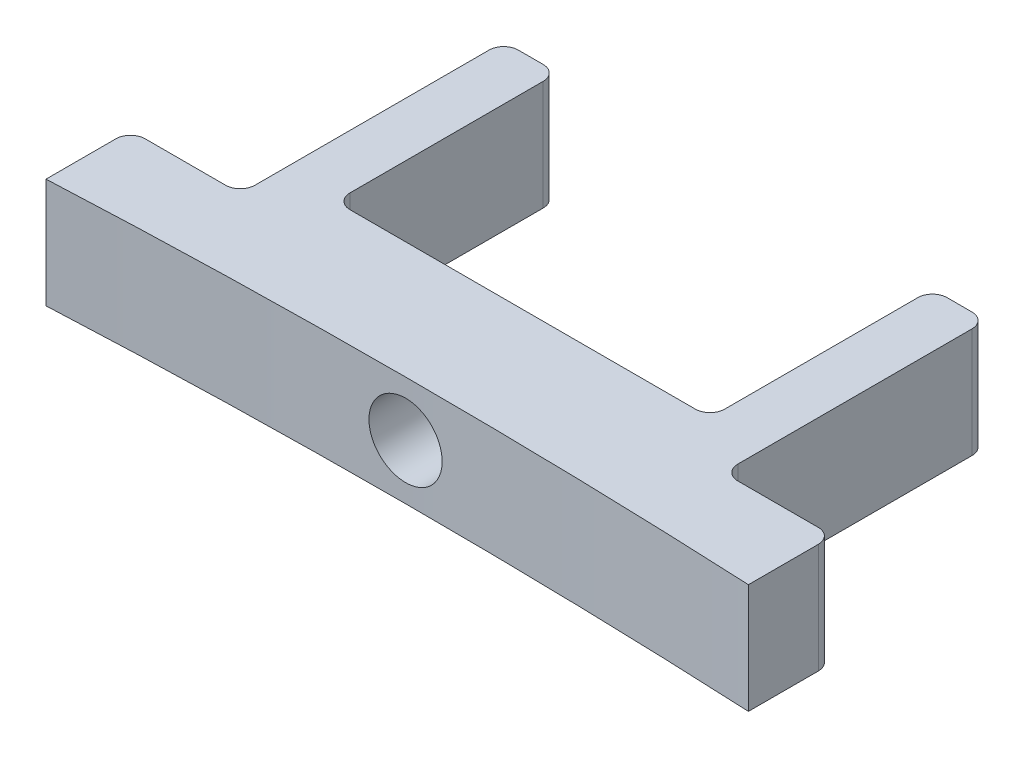
from build123d import *

# Parameters (mm, degrees)
BOSS_EXTRUDE1_DEPTH       = 7.5
BOSS_EXTRUDE2_DEPTH       = 7.5
FILLET1_R                 = 1
M6X1_0_TAPPED_HOLE1_D     = 5
M6X1_0_TAPPED_HOLE1_DEPTH = 9
M6X1_0_TAPPED_HOLE1_TIP   = 1.502151548


with BuildPart() as part:
    # Sketch1 → Boss-Extrude1 (new body)
    with BuildSketch(Plane(origin=(0, 0, 0), x_dir=(1, 0, 0), z_dir=(0, 1, 0))):
        with BuildLine():
            Line((-12, 0), (0, 0))
            Line((0, 0), (12, 0))
            Line((12, 0), (12, -2.8))
            Line((12, -2.8), (24, -2.8))
            Line((24, -2.8), (24, -8.576332159))
            ThreePointArc((24, -8.576332159), (0, -8), (-24, -8.576332159))
            Line((-24, -8.576332159), (-24, -2.8))
            Line((-24, -2.8), (-12, -2.8))
            Line((-12, -2.8), (-12, 0))
        make_face()
    extrude(amount=BOSS_EXTRUDE1_DEPTH)

    # Sketch5 → Boss-Extrude2 (add)
    with BuildSketch(Plane(origin=(0, 7.5, 0), x_dir=(1, 0, 0), z_dir=(0, 1, 0))):
        Polygon((12, 0), (12.8, 0), (12.8, 15.2), (16.5, 15.2), (16.5, -2.8), (12, -2.8), align=None)
        Polygon((-12, -2.8), (-12, 0), (-12.8, 0), (-12.8, 15.2), (-16.5, 15.2), (-16.5, -2.8), align=None)
    extrude(amount=-BOSS_EXTRUDE2_DEPTH)

    # Fillet1
    fillet1_edges = [part.edges().sort_by_distance(p)[0] for p in [
        (24, 3.75, 2.8),
        (-24, 3.75, 2.8),
        (16.5, 3.75, 2.8),
        (16.5, 3.75, -15.2),
        (12.8, 3.75, -15.2),
        (12.8, 3.75, 0),
        (-12.8, 3.75, 0),
        (-12.8, 3.75, -15.2),
        (-16.5, 3.75, -15.2),
        (-16.5, 3.75, 2.8),
    ]]
    fillet(fillet1_edges, radius=FILLET1_R)

    # M6x1.0 Tapped Hole1
    with Locations(Plane(origin=(0, 0, 0), x_dir=(-1, 0, 0), z_dir=(0, 0, -1))):
        with Locations((0, 3.75)):
            Hole(M6X1_0_TAPPED_HOLE1_D / 2, depth=M6X1_0_TAPPED_HOLE1_DEPTH)
            with Locations((0, 0, -(M6X1_0_TAPPED_HOLE1_DEPTH + M6X1_0_TAPPED_HOLE1_TIP / 2))):  # 118° drill point
                Cone(0, M6X1_0_TAPPED_HOLE1_D / 2, M6X1_0_TAPPED_HOLE1_TIP, mode=Mode.SUBTRACT)


solid = part.part
